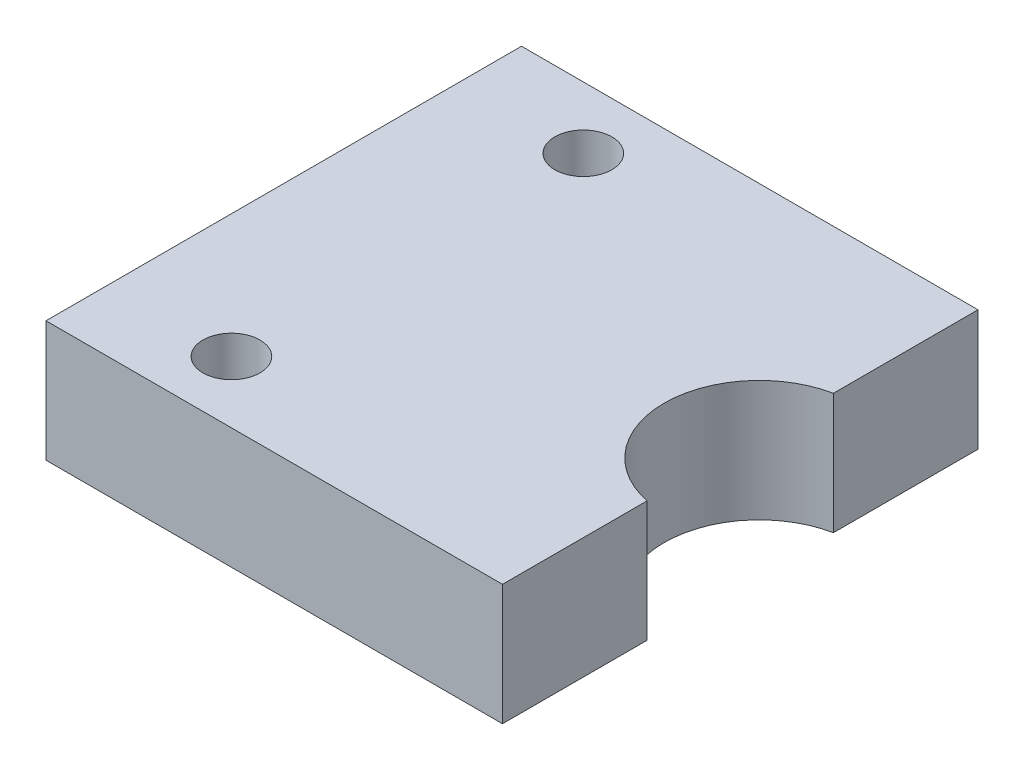
from build123d import *

# Parameters (mm, degrees)
CROQUIS2_R              = 3
SALIENTE_EXTRUIR1_DEPTH = 12.7


with BuildPart() as part:
    # Croquis2 → Saliente-Extruir1 (new body)
    with BuildSketch(Plane(origin=(0, 0, 0), x_dir=(1, 0, 0), z_dir=(0, 1, 0))):
        with BuildLine():
            Line((-2, 25), (-50, 25))
            Line((-50, 25), (-50, -25))
            Line((-50, -25), (-2, -25))
            Line((-2, -25), (-2, -9.797958971))
            ThreePointArc((-2, -9.797958971), (-10, 0), (-2, 9.797958971))
            Line((-2, 9.797958971), (-2, 25))
        make_face()
        with Locations(Location((-37, -18.5, 0), (0, 0, 270))):
            Circle(CROQUIS2_R, mode=Mode.SUBTRACT)
        with Locations(Location((-37, 18.5, 0), (0, 0, 270))):
            Circle(CROQUIS2_R, mode=Mode.SUBTRACT)
    extrude(amount=SALIENTE_EXTRUIR1_DEPTH)


solid = part.part
